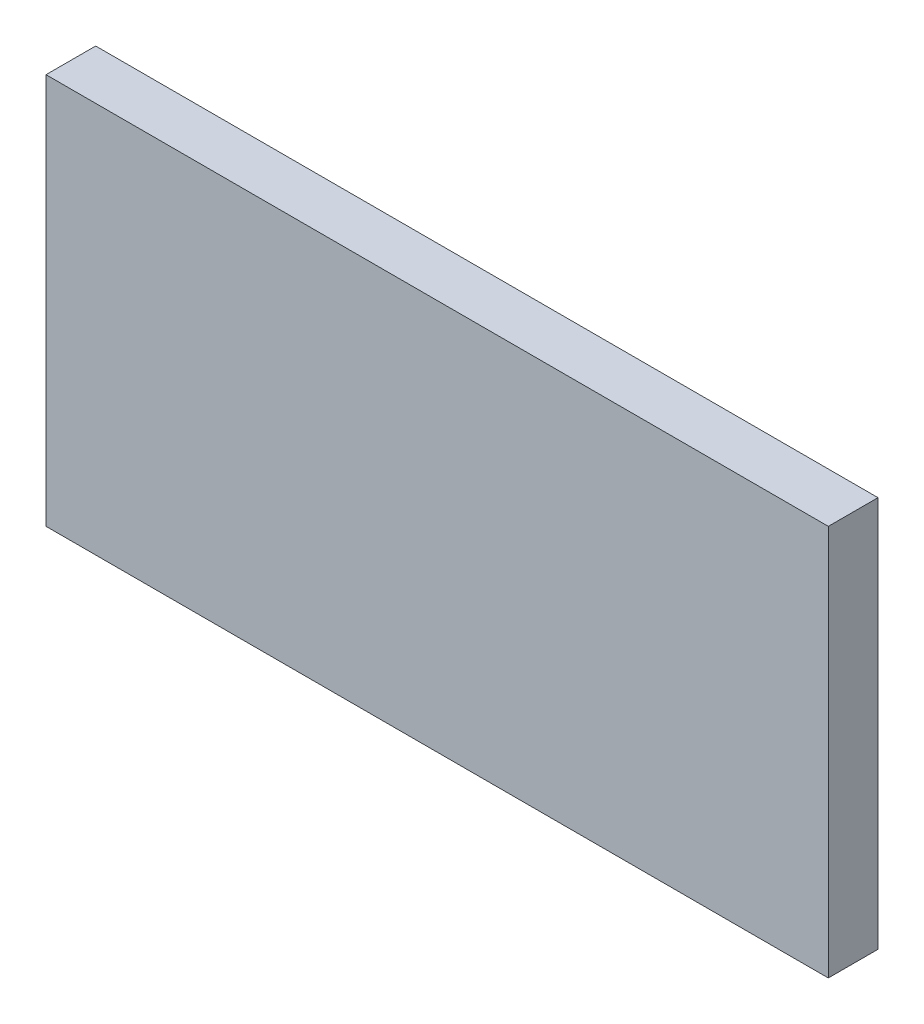
from build123d import *

# Parameters (mm, degrees)
SKETCH1_W  = 50
SKETCH1_H  = 25
BASE_DEPTH = 3.175


with BuildPart() as part:
    # Sketch1 → base (new body)
    with BuildSketch(Plane.XY):
        with Locations((25, 12.5)):
            Rectangle(SKETCH1_W, SKETCH1_H)
    extrude(amount=BASE_DEPTH)


solid = part.part
